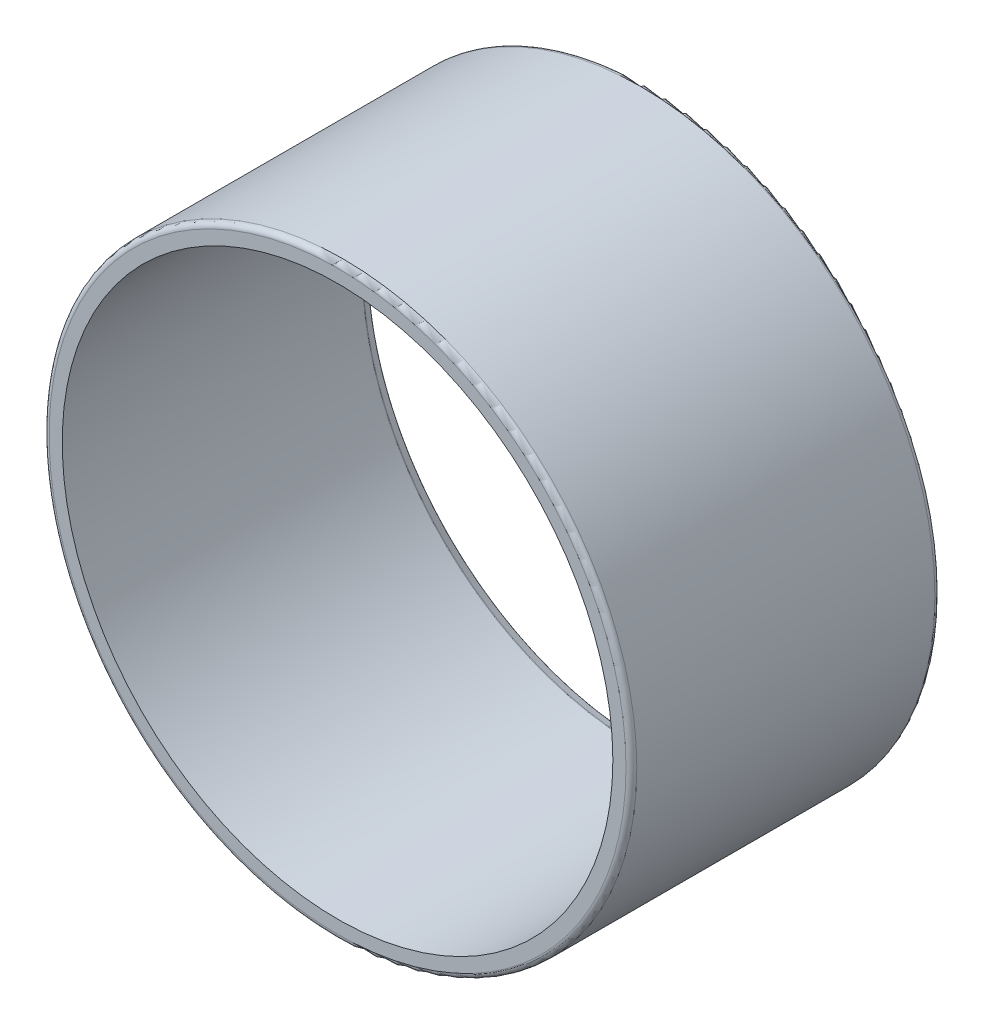
from build123d import *
from OCP.BRepFilletAPI import BRepFilletAPI_MakeFillet

# Parameters (mm, degrees)
FILLET1_R1 = 0.05
FILLET1_R2 = 0.15


with BuildPart() as part:
    # Sketch1 → Revolve1 (revolve)
    with BuildSketch(Plane(origin=(0, 0, 0), x_dir=(0, 0, -1), z_dir=(1, 0, 0))):
        with BuildLine():
            Line((-10, 18.675), (-10, 17.825))
            Line((-10, 17.825), (9.450504516, 17.825))
            Line((9.450504516, 17.825), (10, 18.025))
            Line((10, 18.025), (10, 18.675))
            ThreePointArc((10, 18.675), (9.897487373, 18.922487373), (9.65, 19.025))
            Line((9.65, 19.025), (-9.65, 19.025))
            ThreePointArc((-9.65, 19.025), (-9.897487373, 18.922487373), (-10, 18.675))
        make_face()
    revolve(axis=Axis((0, 0, 11.704423327), (0, 0, -1)))

    # Fillet1: one fillet with a radius per group of edges: ONE call of the kernel's fillet builder (fillet() takes one radius for all edges)
    fillet1_edges_1 = [part.edges().sort_by_distance(p)[0] for p in [
        (0, -18.025, -10),
    ]]
    fillet1_edges_2 = [part.edges().sort_by_distance(p)[0] for p in [
        (0, -17.825, -9.450504516),
    ]]
    fillet1 = BRepFilletAPI_MakeFillet(part.part.solid().wrapped)
    for e in fillet1_edges_1:
        fillet1.Add(FILLET1_R1, e.wrapped)
    for e in fillet1_edges_2:
        fillet1.Add(FILLET1_R2, e.wrapped)
    add(Compound.cast(fillet1.Shape()), mode=Mode.REPLACE)


solid = part.part
